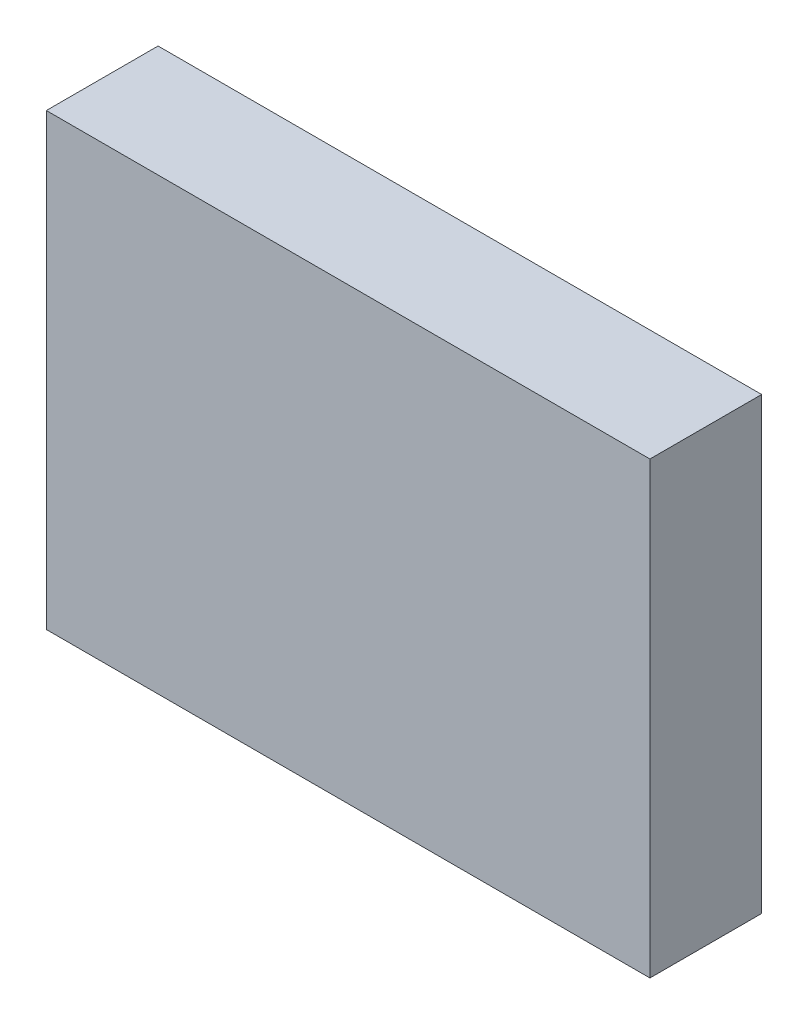
from build123d import *

# Parameters (mm, degrees)
ESBO_O1_W                = 47
ESBO_O1_H                = 35
RESSALTO_EXTRUS_O1_DEPTH = 8.7


with BuildPart() as part:
    # Esboço1 → Ressalto-extrusão1 (new body)
    with BuildSketch(Plane.XY):
        Rectangle(ESBO_O1_W, ESBO_O1_H)
    extrude(amount=RESSALTO_EXTRUS_O1_DEPTH)


solid = part.part
